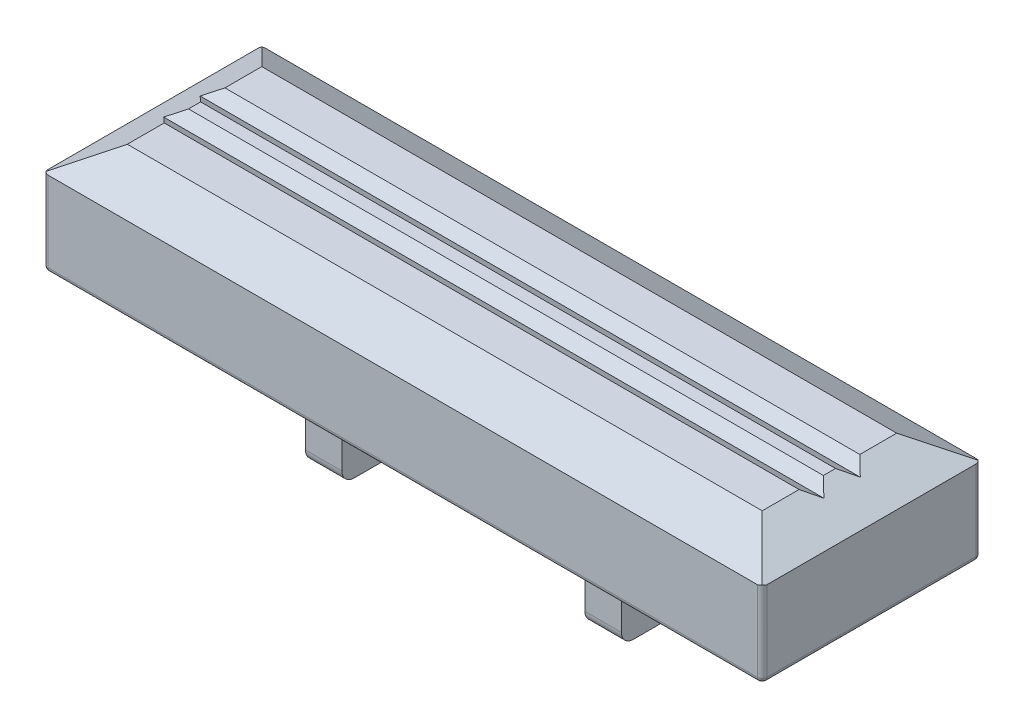
from build123d import *
from OCP.BRepFilletAPI import BRepFilletAPI_MakeChamfer

# Parameters (mm, degrees)
SKETCH_1_W          = 29.6
SKETCH_1_H          = 9
EXTRUDE_1_DEPTH     = 4.5
CUT_EXTRUDE_1_DEPTH = 3
SKETCH_3_W          = 1.5
SKETCH_3_H          = 4
EXTRUDE_2_DEPTH     = 7
SKETCH_4_W          = 2
SKETCH_4_H          = 2
CUT_EXTRUDE_2_DEPTH = 23.230384612
CHAMFER_1_SIZE      = 1
CHAMFER_1_SIZE2     = 1.732050808
CHAMFER_2_SIZE      = 1
CHAMFER_2_SIZE2     = 1.732050808
CUT_EXTRUDE_3_DEPTH = 31.276393444
FILLET_2_R          = 0.2
FILLET_3_R          = 0.5


with BuildPart() as part:
    # 草图1 → 凸台-拉伸1 (new body)
    with BuildSketch(Plane(origin=(0, 0, 0), x_dir=(1, 0, 0), z_dir=(0, 1, 0))):
        Rectangle(SKETCH_1_W, SKETCH_1_H)
    extrude(amount=EXTRUDE_1_DEPTH)

    # 草图2 → 切除-拉伸1 (cut)
    with BuildSketch(Plane.XZ):
        Polygon((-13.3, 0.5), (-13.3, 3), (13.3, 3), (13.3, 0.5), (6.5, 0.5), (6.5, -0.5), (13.3, -0.5), (13.3, -3), (-13.3, -3), (-13.3, -0.5), (-6.5, -0.5), (-6.5, 0.5), align=None)
    extrude(amount=-CUT_EXTRUDE_1_DEPTH, mode=Mode.SUBTRACT)

    # 草图3 → 凸台-拉伸2 (add)
    with BuildSketch(Plane.XZ.offset(-3)):
        with Locations((-5.75, 0)):
            Rectangle(SKETCH_3_W, SKETCH_3_H)
        with Locations((5.75, 0)):
            Rectangle(SKETCH_3_W, SKETCH_3_H)
    extrude(amount=EXTRUDE_2_DEPTH)

    # 草图4 → 切除-拉伸2 (cut, through all)
    with BuildSketch(Plane.ZY.offset(6.5)):
        with Locations((0, -2)):
            Rectangle(SKETCH_4_W, SKETCH_4_H)
    extrude(amount=-CUT_EXTRUDE_2_DEPTH, mode=Mode.SUBTRACT)

    # 倒角1: one chamfer whose edges measure the first distance from different faces: ONE call of the kernel's chamfer builder (chamfer() names one face for all edges)
    chamfer_1_edges_1 = [part.edges().sort_by_distance(p)[0] for p in [
        (0, 4.5, -4.5),
    ]]
    chamfer_1_side_1 = [part.faces().sort_by_distance(p)[0] for p in [
        (0, 2.25, -4.5),
    ]]
    chamfer_1_edges_2 = [part.edges().sort_by_distance(p)[0] for p in [
        (0, 4.5, 4.5),
    ]]
    chamfer_1_side_2 = [part.faces().sort_by_distance(p)[0] for p in [
        (0, 2.25, 4.5),
    ]]
    chamfer_1 = BRepFilletAPI_MakeChamfer(part.part.solid().wrapped)
    for e in chamfer_1_edges_1:
        chamfer_1.Add(CHAMFER_1_SIZE, CHAMFER_1_SIZE2, e.wrapped, chamfer_1_side_1[0].wrapped)  # the first distance lies on this face
    for e in chamfer_1_edges_2:
        chamfer_1.Add(CHAMFER_1_SIZE, CHAMFER_1_SIZE2, e.wrapped, chamfer_1_side_2[0].wrapped)  # the first distance lies on this face
    add(Compound.cast(chamfer_1.Shape()), mode=Mode.REPLACE)

    # 倒角2: one chamfer whose edges measure the first distance from different faces: ONE call of the kernel's chamfer builder (chamfer() names one face for all edges)
    chamfer_2_edges_1 = [part.edges().sort_by_distance(p)[0] for p in [
        (-14.8, 4.5, 0),
    ]]
    chamfer_2_side_1 = [part.faces().sort_by_distance(p)[0] for p in [
        (-14.8, 2.164368335, 0),
    ]]
    chamfer_2_edges_2 = [part.edges().sort_by_distance(p)[0] for p in [
        (14.8, 4.5, 0),
    ]]
    chamfer_2_side_2 = [part.faces().sort_by_distance(p)[0] for p in [
        (14.8, 2.164368335, 0),
    ]]
    chamfer_2 = BRepFilletAPI_MakeChamfer(part.part.solid().wrapped)
    for e in chamfer_2_edges_1:
        chamfer_2.Add(CHAMFER_2_SIZE, CHAMFER_2_SIZE2, e.wrapped, chamfer_2_side_1[0].wrapped)  # the first distance lies on this face
    for e in chamfer_2_edges_2:
        chamfer_2.Add(CHAMFER_2_SIZE, CHAMFER_2_SIZE2, e.wrapped, chamfer_2_side_2[0].wrapped)  # the first distance lies on this face
    add(Compound.cast(chamfer_2.Shape()), mode=Mode.REPLACE)

    # 草图5 → 切除-拉伸3 (cut, through all)
    with BuildSketch(Plane.ZY.offset(14.8)):
        Polygon((-1.25, 4.5), (-0.25, 4.5), (-0.75, 4.2), align=None)
        Polygon((0.75, 4.2), (1.25, 4.5), (0.25, 4.5), align=None)
    extrude(amount=-CUT_EXTRUDE_3_DEPTH, mode=Mode.SUBTRACT)

    # 圆角2
    fillet_2_edges = [part.edges().sort_by_distance(p)[0] for p in [
        (-14.8, 1.75, 4.5),
        (-14.8, 1.75, -4.5),
        (14.8, 1.75, -4.5),
        (14.8, 1.75, 4.5),
        (0, 0, -4.5),
        (14.8, 0, 0),
        (0, 0, 4.5),
        (-14.8, 0, 0),
    ]]
    fillet(fillet_2_edges, radius=FILLET_2_R)

    # 圆角3
    fillet_3_edges = [part.edges().sort_by_distance(p)[0] for p in [
        (-5.75, -4, -2),
        (-5.75, -4, 2),
        (5.75, -4, -2),
        (5.75, -4, 2),
    ]]
    fillet(fillet_3_edges, radius=FILLET_3_R)


solid = part.part
